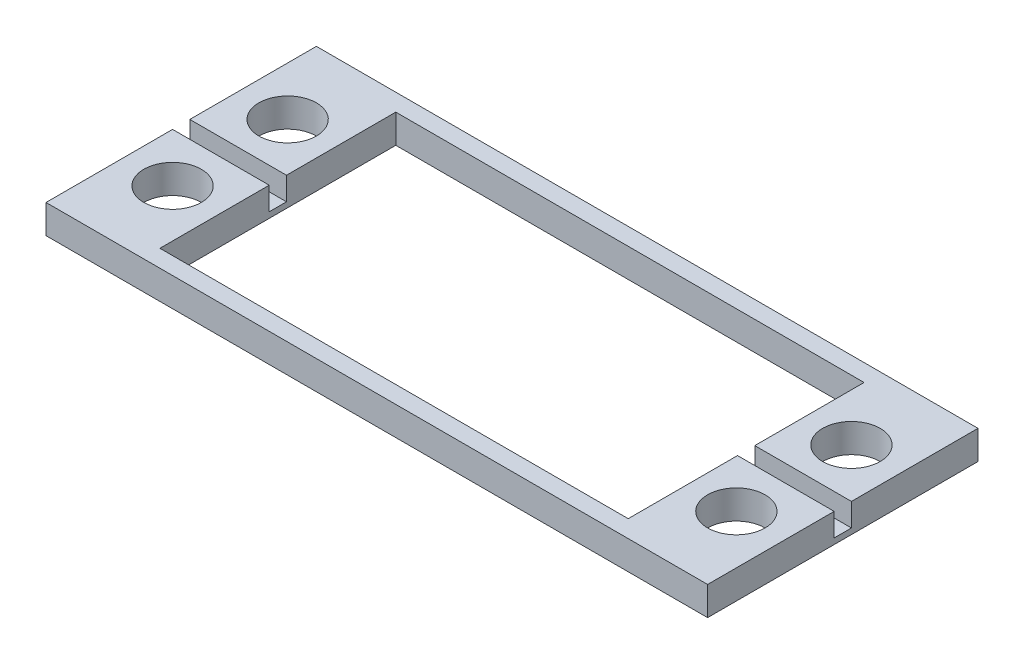
from build123d import *

# Parameters (mm, degrees)
SKETCH2_W           = 57.5
SKETCH2_H           = 23.5
SKETCH2_R           = 2.5
SKETCH2_W_2         = 40.7
SKETCH2_H_2         = 20.5
BOSS_EXTRUDE1_DEPTH = 2.5
CUT_EXTRUDE1_DEPTH  = 2


with BuildPart() as part:
    # Sketch2 → Boss-Extrude1 (new body)
    with BuildSketch(Plane(origin=(0, 0, 0), x_dir=(1, 0, 0), z_dir=(0, 1, 0))):
        with Locations((-47.929083034, 36.809921321)):
            Rectangle(SKETCH2_W, SKETCH2_H)
        with Locations(Location((-23.429083034, 41.809921321, 0), (0, 0, 270))):
            Circle(SKETCH2_R, mode=Mode.SUBTRACT)
        with Locations(Location((-23.429083034, 31.809921321, 0), (0, 0, 90))):
            Circle(SKETCH2_R, mode=Mode.SUBTRACT)
        with Locations(Location((-72.429083034, 31.809921321, 0), (0, 0, 270))):
            Circle(SKETCH2_R, mode=Mode.SUBTRACT)
        with Locations(Location((-72.429083034, 41.809921321, 0), (0, 0, 90))):
            Circle(SKETCH2_R, mode=Mode.SUBTRACT)
        with Locations((-47.929083034, 36.809921321)):
            Rectangle(SKETCH2_W_2, SKETCH2_H_2, mode=Mode.SUBTRACT)
    extrude(amount=BOSS_EXTRUDE1_DEPTH)

    # Sketch3 → Cut-Extrude1 (cut)
    with BuildSketch(Plane(origin=(0, 2.5, 0), x_dir=(1, 0, 0), z_dir=(0, 1, 0))):
        Polygon((-27.579083034, 36.809921321), (-27.579083034, 36.059921321), (-19.179083034, 36.059921321), (-19.179083034, 37.559921321), (-27.579083034, 37.559921321), align=None)
        Polygon((-76.679083034, 37.559921321), (-68.279083034, 37.559921321), (-68.279083034, 36.809921321), (-68.279083034, 36.059921321), (-76.679083034, 36.059921321), align=None)
    extrude(amount=-CUT_EXTRUDE1_DEPTH, mode=Mode.SUBTRACT)


solid = part.part
